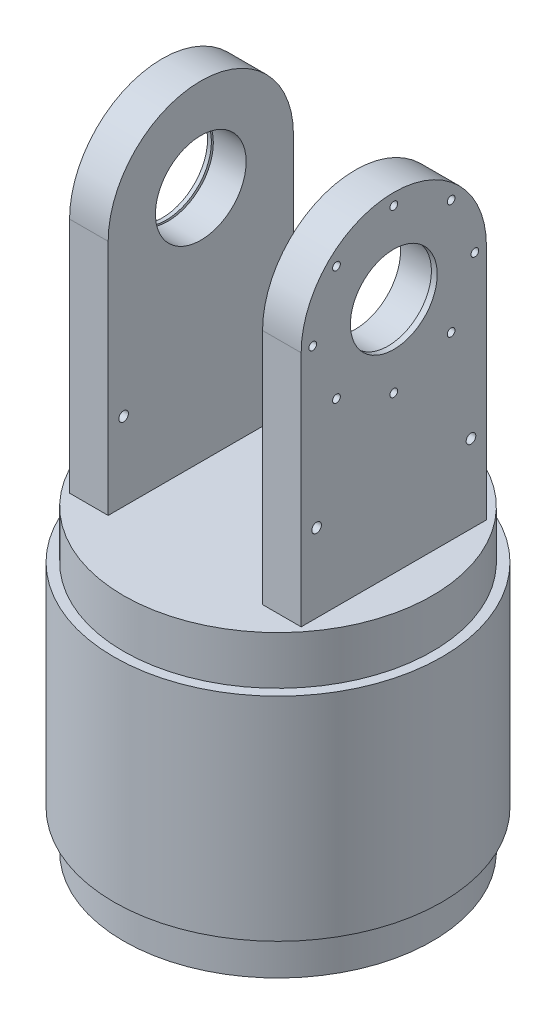
from build123d import *

# Parameters (mm, degrees)
SKETCH1_R                       = 85
SKETCH1_R_2                     = 75
BOSS_EXTRUDE1_DEPTH             = 150
SKETCH1_4_R                     = 80
SKETCH1_4_R_2                   = 75
CUT_EXTRUDE1_DEPTH              = 155
SKETCH2_R                       = 85
BOSS_EXTRUDE3_DEPTH             = 5
BOSS_EXTRUDE4_DEPTH             = 176
BOSS_EXTRUDE5_DEPTH             = 176
SKETCH3_R                       = 23.5
CUT_EXTRUDE3_DEPTH              = 90
SKETCH3_3_R                     = 23.5
CUT_EXTRUDE4_DEPTH              = 120
CUT_EXTRUDE5_DEPTH              = 20
CUT_EXTRUDE6_START              = -20
CUT_EXTRUDE6_DEPTH              = 20
SKETCH6_R                       = 2
CUT_EXTRUDE7_DEPTH              = 20
SKETCH11_R                      = 2.5
CUT_EXTRUDE10_DEPTH             = 131
SKETCH1_7_R                     = 80
SKETCH1_7_R_2                   = 75
BOSS_EXTRUDE6_DEPTH             = 155
CUT_EXTRUDE12_DEPTH             = 20
CUT_EXTRUDE12_DEPTH_BACK        = 10
SKETCH1_10_R                    = 85
SKETCH1_10_R_2                  = 80
CUT_EXTRUDE13_START             = -25
SKETCH12_R                      = 85
SKETCH12_R_2                    = 80
CUT_EXTRUDE13_DEPTH             = 25
SKETCH1_11_R                    = 75
BOSS_EXTRUDE7_DEPTH             = 5
F_5_0MM_DOWEL_HOLE1_D           = 5
F_5_0MM_DOWEL_HOLE1_DEPTH       = 5
F_5_0MM_DOWEL_HOLE1_CSINK_D     = 5.05
F_5_0MM_DOWEL_HOLE1_CSINK_ANGLE = 90
F_5_0MM_DOWEL_HOLE1_TIP         = 1.502151548
SKETCH3_4_R                     = 23.5
SKETCH3_4_R_2                   = 22.5
BOSS_EXTRUDE8_DEPTH             = 3
SKETCH16_R                      = 25
CUT_EXTRUDE14_DEPTH             = 1


with BuildPart() as part:
    # Sketch1 → Boss-Extrude1 (new body)
    with BuildSketch(Plane(origin=(0, 0, 0), x_dir=(1, 0, 0), z_dir=(0, 1, 0))):
        Circle(SKETCH1_R)
        Circle(SKETCH1_R_2, mode=Mode.SUBTRACT)
    extrude(amount=BOSS_EXTRUDE1_DEPTH)

    # Sketch1<4> → Cut-Extrude1 (cut)
    with BuildSketch(Plane(origin=(0, 0, 0), x_dir=(1, 0, 0), z_dir=(0, 1, 0))):
        Circle(SKETCH1_4_R)
        Circle(SKETCH1_4_R_2, mode=Mode.SUBTRACT)
    extrude(amount=CUT_EXTRUDE1_DEPTH, mode=Mode.SUBTRACT)

    # Sketch2 → Boss-Extrude3 (add)
    with BuildSketch(Plane(origin=(0, 150, 0), x_dir=(1, 0, 0), z_dir=(0, 1, 0))):
        Circle(SKETCH2_R)
    extrude(amount=BOSS_EXTRUDE3_DEPTH)

    # Sketch2<3> → Boss-Extrude4 (add)
    with BuildSketch(Plane(origin=(0, 150, 0), x_dir=(1, 0, 0), z_dir=(0, 1, 0))):
        Polygon((60, 48), (40, 48), (40, 0), (40, -48), (60, -48), align=None)
    extrude(amount=BOSS_EXTRUDE4_DEPTH)

    # Sketch2<4> → Boss-Extrude5 (add)
    with BuildSketch(Plane(origin=(0, 150, 0), x_dir=(1, 0, 0), z_dir=(0, 1, 0))):
        Polygon((-40, -48), (-40, 0), (-40, 48), (-60, 48), (-60, -48), align=None)
    extrude(amount=BOSS_EXTRUDE5_DEPTH)

    # Sketch3 → Cut-Extrude3 (cut)
    with BuildSketch(Plane(origin=(60, 0, 0), x_dir=(0, 0, -1), z_dir=(1, 0, 0))):
        with Locations((0, 278)):
            Circle(SKETCH3_R)
    extrude(amount=-CUT_EXTRUDE3_DEPTH, mode=Mode.SUBTRACT)

    # Sketch3<3> → Cut-Extrude4 (cut)
    with BuildSketch(Plane(origin=(60, 0, 0), x_dir=(0, 0, -1), z_dir=(1, 0, 0))):
        with Locations((0, 278)):
            Circle(SKETCH3_3_R)
    extrude(amount=-CUT_EXTRUDE4_DEPTH, mode=Mode.SUBTRACT)

    # Sketch4 → Cut-Extrude5 (cut)
    with BuildSketch(Plane(origin=(60, 0, 0), x_dir=(0, 0, -1), z_dir=(1, 0, 0))):
        with BuildLine():
            Line((-48, 326), (-48, 278))
            ThreePointArc((-48, 278), (-33.941125268, 311.941125726), (6.48e-07, 326))
            Line((6.48e-07, 326), (-48, 326))
        make_face()
        with BuildLine():
            ThreePointArc((6.48e-07, 326), (33.941125726, 311.941125268), (48, 278))
            Line((48, 278), (48, 326))
            Line((48, 326), (6.48e-07, 326))
        make_face()
    extrude(amount=-CUT_EXTRUDE5_DEPTH, mode=Mode.SUBTRACT)

    # Sketch5 → Cut-Extrude6 (cut)
    with BuildSketch(Plane.ZY.offset(60).offset(CUT_EXTRUDE6_START)):
        with BuildLine():
            Line((-48, 326), (-48, 278))
            ThreePointArc((-48, 278), (-33.941125497, 311.941125497), (0, 326))
            Line((0, 326), (-48, 326))
        make_face()
        with BuildLine():
            ThreePointArc((0, 326), (33.941125497, 311.941125497), (48, 278))
            Line((48, 278), (48, 326))
            Line((48, 326), (0, 326))
        make_face()
    extrude(amount=CUT_EXTRUDE6_DEPTH, mode=Mode.SUBTRACT)

    # Sketch6 → Cut-Extrude7 (cut)
    with BuildSketch(Plane(origin=(60, 0, 0), x_dir=(0, 0, -1), z_dir=(1, 0, 0))):
        with Locations((0, 320)):
            Circle(SKETCH6_R)
        with Locations((29.69848481, 307.69848481)):
            Circle(SKETCH6_R)
        with Locations((42, 278)):
            Circle(SKETCH6_R)
        with Locations((29.69848481, 248.30151519)):
            Circle(SKETCH6_R)
        with Locations((0, 236)):
            Circle(SKETCH6_R)
        with Locations((-29.69848481, 248.30151519)):
            Circle(SKETCH6_R)
        with Locations((-42, 278)):
            Circle(SKETCH6_R)
        with Locations((-29.69848481, 307.69848481)):
            Circle(SKETCH6_R)
    extrude(amount=-CUT_EXTRUDE7_DEPTH, mode=Mode.SUBTRACT)

    # Sketch11 → Cut-Extrude10 (cut)
    with BuildSketch(Plane(origin=(60, 0, 0), x_dir=(0, 0, -1), z_dir=(1, 0, 0))):
        with Locations((-40, 195.5)):
            Circle(SKETCH11_R)
        with Locations((40, 195.5)):
            Circle(SKETCH11_R)
    extrude(amount=-CUT_EXTRUDE10_DEPTH, mode=Mode.SUBTRACT)

    # Sketch1<7> → Boss-Extrude6 (add)
    with BuildSketch(Plane(origin=(0, 0, 0), x_dir=(1, 0, 0), z_dir=(0, 1, 0))):
        Circle(SKETCH1_7_R)
        Circle(SKETCH1_7_R_2, mode=Mode.SUBTRACT)
    extrude(amount=BOSS_EXTRUDE6_DEPTH)

    # Sketch1<10> → Cut-Extrude12 (cut, two sides: drawn at the far end of the back side and taken through both)
    with BuildSketch(Plane(origin=(0, 0, 0), x_dir=(1, 0, 0), z_dir=(0, 1, 0)).offset(-CUT_EXTRUDE12_DEPTH_BACK)):
        Circle(SKETCH1_10_R)
        Circle(SKETCH1_10_R_2, mode=Mode.SUBTRACT)
    extrude(amount=CUT_EXTRUDE12_DEPTH + CUT_EXTRUDE12_DEPTH_BACK, mode=Mode.SUBTRACT)

    # Sketch12 → Cut-Extrude13 (cut)
    with BuildSketch(Plane(origin=(0, 155, 0), x_dir=(1, 0, 0), z_dir=(0, 1, 0)).offset(CUT_EXTRUDE13_START)):
        Circle(SKETCH12_R)
        Circle(SKETCH12_R_2, mode=Mode.SUBTRACT)
    extrude(amount=CUT_EXTRUDE13_DEPTH, mode=Mode.SUBTRACT)

    # Sketch1<11> → Boss-Extrude7 (add)
    with BuildSketch(Plane(origin=(0, 0, 0), x_dir=(1, 0, 0), z_dir=(0, 1, 0))):
        Circle(SKETCH1_11_R)
    extrude(amount=BOSS_EXTRUDE7_DEPTH)

    # Ø5.0mm Dowel Hole1
    with Locations(Plane(origin=(0, 0, 0), x_dir=(-1, 0, 0), z_dir=(0, -1, 0))):
        with Locations((12.340862004, 7.125), (-12.340862004, 7.125), (0, -14.25)):
            CounterSinkHole(F_5_0MM_DOWEL_HOLE1_D / 2, F_5_0MM_DOWEL_HOLE1_CSINK_D / 2, depth=F_5_0MM_DOWEL_HOLE1_DEPTH, counter_sink_angle=F_5_0MM_DOWEL_HOLE1_CSINK_ANGLE)
            with Locations((0, 0, -(F_5_0MM_DOWEL_HOLE1_DEPTH + F_5_0MM_DOWEL_HOLE1_TIP / 2))):  # 118° drill point
                Cone(0, F_5_0MM_DOWEL_HOLE1_D / 2, F_5_0MM_DOWEL_HOLE1_TIP, mode=Mode.SUBTRACT)

    # Sketch3<4> → Boss-Extrude8 (add)
    with BuildSketch(Plane(origin=(60, 0, 0), x_dir=(0, 0, -1), z_dir=(1, 0, 0))):
        with Locations((0, 278)):
            Circle(SKETCH3_4_R)
        with Locations((0, 278)):
            Circle(SKETCH3_4_R_2, mode=Mode.SUBTRACT)
    extrude(amount=-BOSS_EXTRUDE8_DEPTH)

    # Sketch16 → Cut-Extrude14 (cut)
    with BuildSketch(Plane.ZY.offset(57)):
        with Locations((0, 278)):
            Circle(SKETCH16_R)
    extrude(amount=CUT_EXTRUDE14_DEPTH, mode=Mode.SUBTRACT)


solid = part.part
